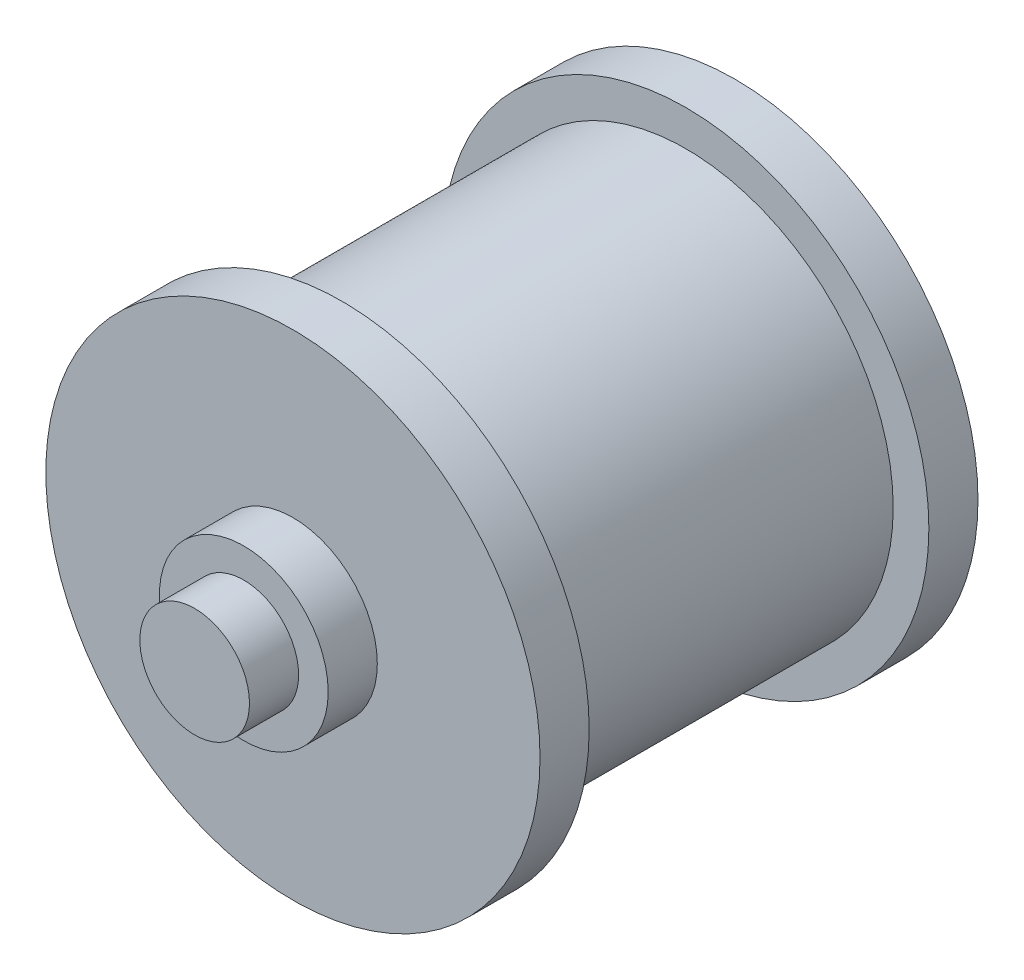
from build123d import *

# Parameters (mm, degrees)
SKETCH1_R           = 49.444265543
BOSS_EXTRUDE1_DEPTH = 10
SKETCH4_R           = 42.186355854
BOSS_EXTRUDE2_DEPTH = 70
SKETCH5_R           = 50.299469204
BOSS_EXTRUDE3_DEPTH = 10
SKETCH6_R           = 13.695749192
BOSS_EXTRUDE4_DEPTH = 10
SKETCH7_R           = 9.193746995
BOSS_EXTRUDE5_DEPTH = 10
SKETCH8_R           = 17.176734278
BOSS_EXTRUDE6_DEPTH = 10
SKETCH9_R           = 11.157494919
BOSS_EXTRUDE7_DEPTH = 10
SCALE1_SCALE        = 0.9
SCALE2_SCALE        = 0.7


with BuildPart() as part:
    # Sketch1 → Boss-Extrude1 (new body)
    with BuildSketch(Plane.XY):
        Circle(SKETCH1_R)
    extrude(amount=BOSS_EXTRUDE1_DEPTH)

    # Sketch4 → Boss-Extrude2 (add)
    with BuildSketch(Plane.XY.offset(10)):
        Circle(SKETCH4_R)
    extrude(amount=BOSS_EXTRUDE2_DEPTH)

    # Sketch5 → Boss-Extrude3 (add)
    with BuildSketch(Plane.XY.offset(80)):
        Circle(SKETCH5_R)
    extrude(amount=BOSS_EXTRUDE3_DEPTH)

    # Sketch6 → Boss-Extrude4 (add)
    with BuildSketch(Plane(origin=(0, 0, 0), x_dir=(-1, 0, 0), z_dir=(0, 0, -1))):
        Circle(SKETCH6_R)
    extrude(amount=BOSS_EXTRUDE4_DEPTH)

    # Sketch7 → Boss-Extrude5 (add)
    with BuildSketch(Plane(origin=(0, 0, -10), x_dir=(-1, 0, 0), z_dir=(0, 0, -1))):
        Circle(SKETCH7_R)
    extrude(amount=BOSS_EXTRUDE5_DEPTH)

    # Sketch8 → Boss-Extrude6 (add)
    with BuildSketch(Plane.XY.offset(90)):
        Circle(SKETCH8_R)
    extrude(amount=BOSS_EXTRUDE6_DEPTH)

    # Sketch9 → Boss-Extrude7 (add)
    with BuildSketch(Plane.XY.offset(100)):
        Circle(SKETCH9_R)
    extrude(amount=BOSS_EXTRUDE7_DEPTH)


with BuildPart() as part_1:
    # Scale1: scaled about (0, 0, 45.617034172)
    add(part.part.scale(SCALE1_SCALE).moved(Location((0, 0, 4.561703417))))


with BuildPart() as part_2:
    # Scale2: scaled about (0, 0, 45.617034172)
    add(part_1.part.scale(SCALE2_SCALE).moved(Location((0, 0, 13.685110252))))


solid = part_2.part
